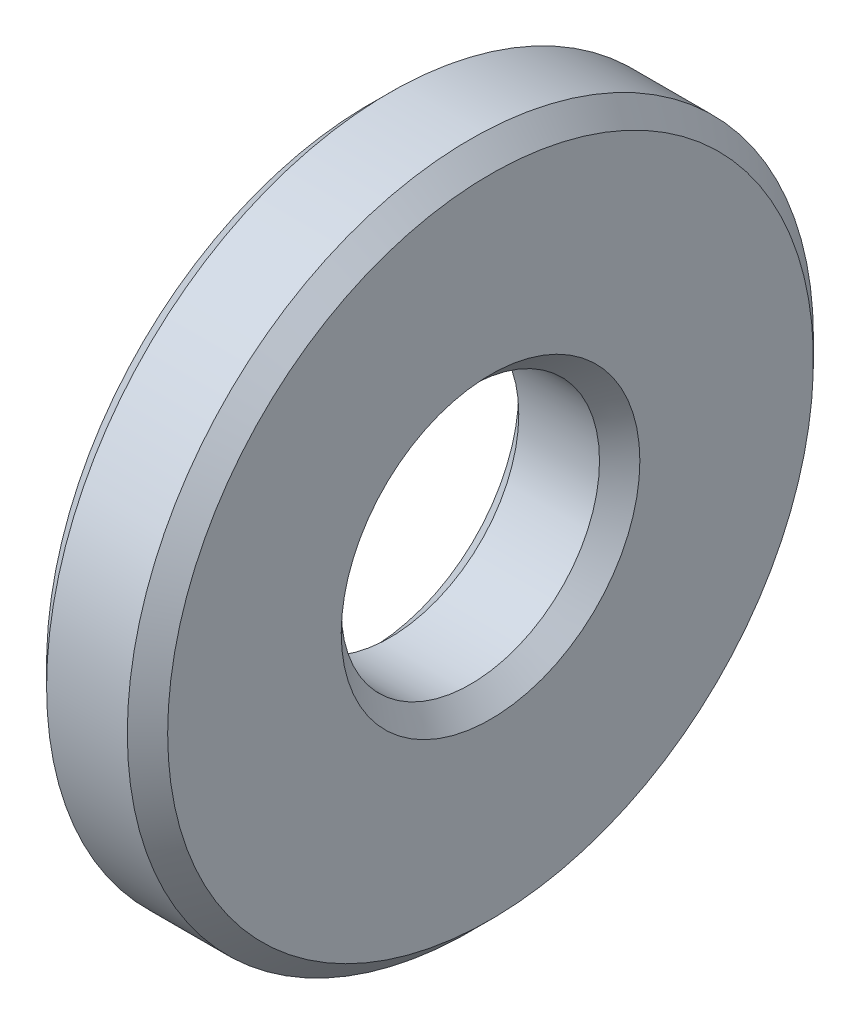
from build123d import *

# Parameters (mm, degrees)
ESQUISSE1_W     = 3
ESQUISSE1_H     = 5.3
CHANFREIN1_SIZE = 0.5


with BuildPart() as part:
    # Esquisse1 → Base-Révolution (revolve)
    with BuildSketch(Plane.XY, mode=Mode.PRIVATE) as base_r_volution_sk:
        with Locations((1.5, 5.85)):
            Rectangle(ESQUISSE1_W, ESQUISSE1_H)
    revolve(base_r_volution_sk.sketch.rotate(Axis((0, 0, 0), (1, 0, 0)), 90), axis=Axis((0, 0, 0), (1, 0, 0)))

    # Chanfrein1
    chanfrein1_edges = [part.edges().sort_by_distance(p)[0] for p in [
        (0, 0, -3.2),
        (3, 0, -3.2),
        (3, 0, -8.5),
        (0, 0, -8.5),
    ]]
    chamfer(chanfrein1_edges, length=CHANFREIN1_SIZE)


solid = part.part
